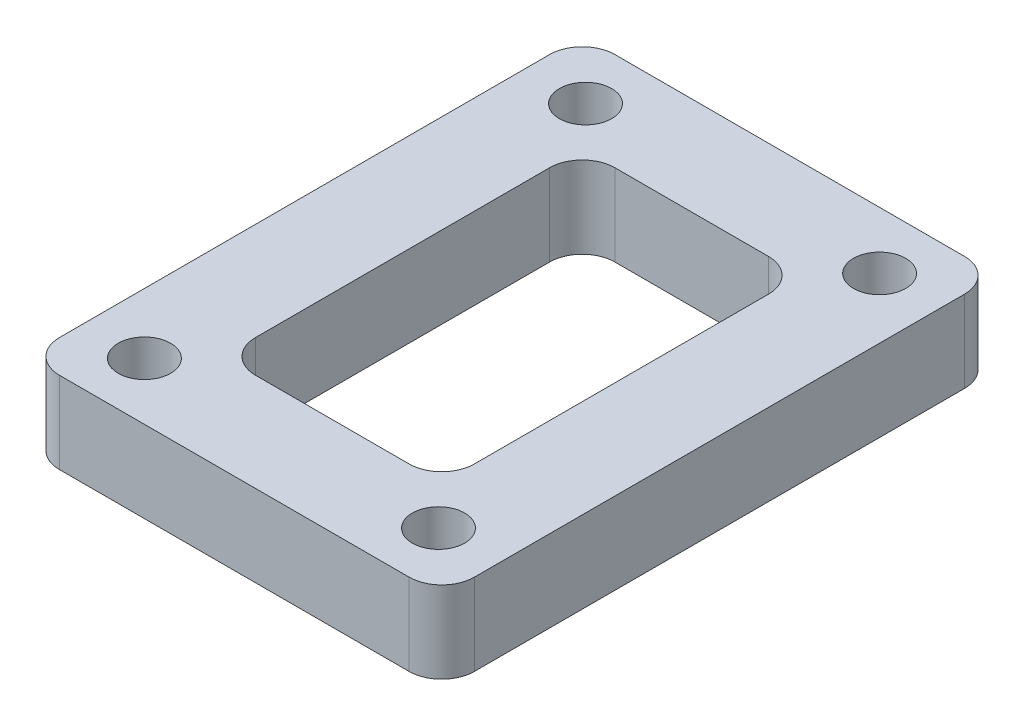
from build123d import *

# Parameters (mm, degrees)
SKETCH_1_W      = 25.4
SKETCH_1_H      = 34
SKETCH_1_R      = 1.6
SKETCH_1_W_2    = 13.4
SKETCH_1_H_2    = 22
EXTRUDE_1_DEPTH = 5
FILLET_1_R      = 2


with BuildPart() as part:
    # 草图1 → 凸台-拉伸1 (new body)
    with BuildSketch(Plane(origin=(0, 0, 0), x_dir=(1, 0, 0), z_dir=(0, 1, 0))):
        Rectangle(SKETCH_1_W, SKETCH_1_H)
        with Locations(Location((-9, 13.5, 0), (0, 0, 270))):
            Circle(SKETCH_1_R, mode=Mode.SUBTRACT)
        with Locations(Location((9, 13.5, 0), (0, 0, 90))):
            Circle(SKETCH_1_R, mode=Mode.SUBTRACT)
        with Locations(Location((9, -13.5, 0), (0, 0, 270))):
            Circle(SKETCH_1_R, mode=Mode.SUBTRACT)
        with Locations(Location((-9, -13.5, 0), (0, 0, 90))):
            Circle(SKETCH_1_R, mode=Mode.SUBTRACT)
        Rectangle(SKETCH_1_W_2, SKETCH_1_H_2, mode=Mode.SUBTRACT)
    extrude(amount=EXTRUDE_1_DEPTH)

    # 圆角1
    fillet_1_edges = [part.edges().sort_by_distance(p)[0] for p in [
        (6.7, 2.5, -11),
        (-6.7, 2.5, -11),
        (-6.7, 2.5, 11),
        (6.7, 2.5, 11),
        (12.7, 2.5, 17),
        (-12.7, 2.5, 17),
        (-12.7, 2.5, -17),
        (12.7, 2.5, -17),
    ]]
    fillet(fillet_1_edges, radius=FILLET_1_R)


solid = part.part
